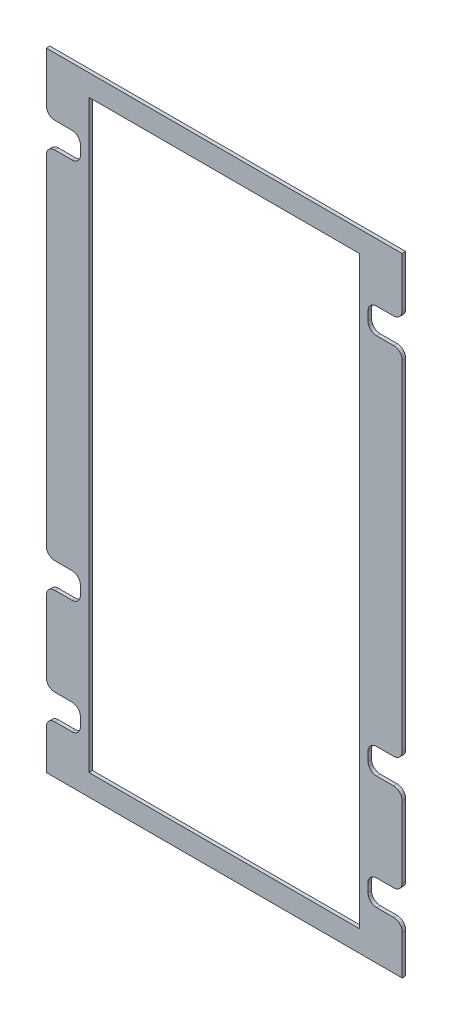
from build123d import *

# Parameters (mm, degrees)
SKETCH1_W           = 317.5
SKETCH1_H           = 559.70678
BOSS_EXTRUDE1_DEPTH = 3.175
SKETCH5_W           = 30.48
SKETCH5_H           = 22.86
CUT_EXTRUDE1_DEPTH  = 322.760101659
FILLET1_R           = 7.62
SKETCH5_3_W         = 241.3
SKETCH5_3_H         = 521.60678
CUT_EXTRUDE2_DEPTH  = 322.760101659


with BuildPart() as part:
    # Sketch1 → Boss-Extrude1 (new body)
    with BuildSketch(Plane.XY):
        Rectangle(SKETCH1_W, SKETCH1_H)
    extrude(amount=BOSS_EXTRUDE1_DEPTH)

    # Sketch5 → Cut-Extrude1 (cut, through all)
    with BuildSketch(Plane(origin=(0, 0, 0), x_dir=(-1, 0, 0), z_dir=(0, 0, -1))):
        with Locations((143.51, 216.35593)):
            Rectangle(SKETCH5_W, SKETCH5_H)
        with Locations((143.51, -225.42373)):
            Rectangle(SKETCH5_W, SKETCH5_H)
        with Locations((143.51, -123.82881)):
            Rectangle(SKETCH5_W, SKETCH5_H)
    cut_extrude1 = extrude(amount=-CUT_EXTRUDE1_DEPTH, mode=Mode.SUBTRACT)

    # Mirror1: Cut-Extrude1 across plane
    add(cut_extrude1.mirror(Plane(origin=(0, 0, 0), x_dir=(0, 0, 1), z_dir=(1, 0, 0))), mode=Mode.SUBTRACT)

    # Fillet1
    fillet1_edges = [part.edges().sort_by_distance(p)[0] for p in [
        (-158.75, -236.85373, 1.5875),
        (-128.27, -236.85373, 1.5875),
        (-128.27, -213.99373, 1.5875),
        (-158.75, -213.99373, 1.5875),
        (-158.75, -135.25881, 1.5875),
        (-128.27, -135.25881, 1.5875),
        (-128.27, -112.39881, 1.5875),
        (-158.75, -112.39881, 1.5875),
        (-158.75, 204.92593, 1.5875),
        (-128.27, 204.92593, 1.5875),
        (-128.27, 227.78593, 1.5875),
        (-158.75, 227.78593, 1.5875),
        (158.75, 227.78593, 1.5875),
        (128.27, 227.78593, 1.5875),
        (128.27, 204.92593, 1.5875),
        (158.75, 204.92593, 1.5875),
        (158.75, -112.39881, 1.5875),
        (128.27, -112.39881, 1.5875),
        (128.27, -135.25881, 1.5875),
        (158.75, -135.25881, 1.5875),
        (158.75, -213.99373, 1.5875),
        (128.27, -213.99373, 1.5875),
        (128.27, -236.85373, 1.5875),
        (158.75, -236.85373, 1.5875),
    ]]
    fillet(fillet1_edges, radius=FILLET1_R)

    # Sketch5<3> → Cut-Extrude2 (cut, through all)
    with BuildSketch(Plane(origin=(0, 0, 0), x_dir=(-1, 0, 0), z_dir=(0, 0, -1))):
        Rectangle(SKETCH5_3_W, SKETCH5_3_H)
    extrude(amount=-CUT_EXTRUDE2_DEPTH, mode=Mode.SUBTRACT)


solid = part.part
